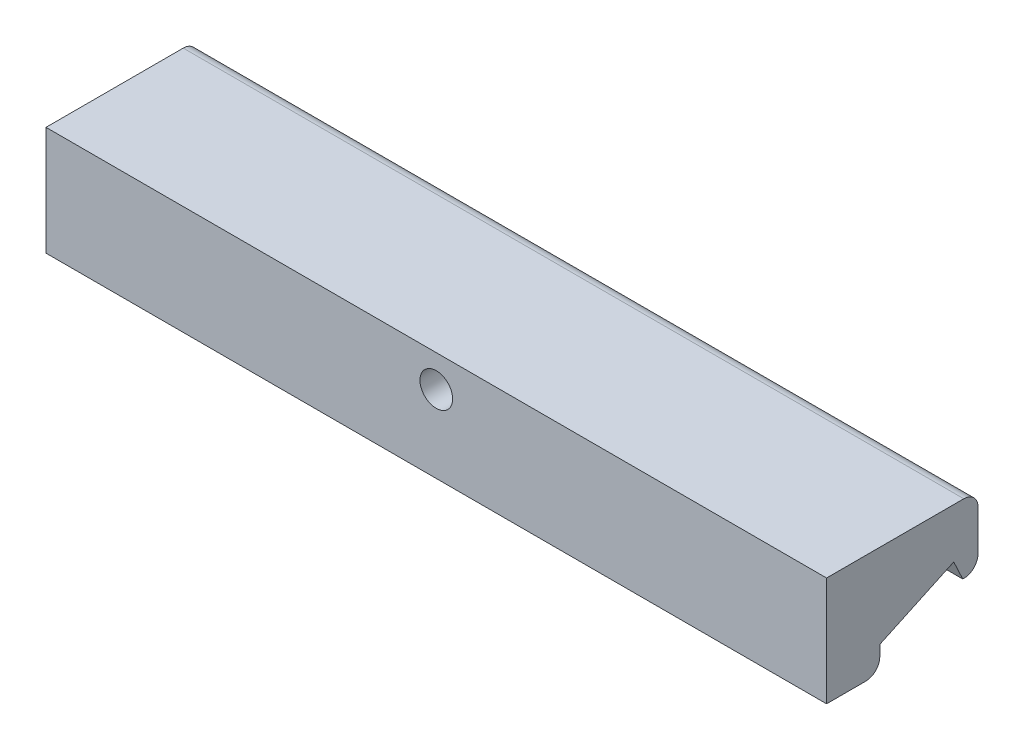
from build123d import *

# Parameters (mm, degrees)
PROFILEBOSS_EXTRUDE1_DEPTH      = 110
SKETCH3_R                       = 2.3
MOUNTINGHOLESCUT_EXTRUDE3_DEPTH = 4.5


with BuildPart() as part:
    # Sketch1 → ProfileBoss-Extrude1 (new body)
    with BuildSketch(Plane(origin=(0, 0, 0), x_dir=(0, 0, -1), z_dir=(1, 0, 0))):
        with BuildLine():
            Line((0, 0), (5.499461553, 0))
            ThreePointArc((5.499461553, 0), (6.914055855, 0.585944145), (7.5, 2.000538447))
            Line((7.5, 2.000538447), (7.5, 3.5))
            Line((7.5, 3.5), (17.922539551, 8.36011001))
            Line((17.922539551, 8.36011001), (19.190394336, 5.641186649))
            ThreePointArc((19.190394336, 5.641186649), (20.700753359, 6.16912635), (21.340729536, 7.635528477))
            Line((21.340729536, 7.635528477), (21.340729536, 13.36011001))
            ThreePointArc((21.340729536, 13.36011001), (20.754943098, 14.774323572), (19.340729536, 15.36011001))
            Line((19.340729536, 15.36011001), (0, 15.36011001))
            Line((0, 15.36011001), (0, 0))
        make_face()
    extrude(amount=PROFILEBOSS_EXTRUDE1_DEPTH)

    # Sketch3 → MountingHolesCut-Extrude3 (cut)
    with BuildSketch(Plane.XY):
        with Locations((55, 10.86011001)):
            Circle(SKETCH3_R)
    extrude(amount=-MOUNTINGHOLESCUT_EXTRUDE3_DEPTH, mode=Mode.SUBTRACT)


solid = part.part
